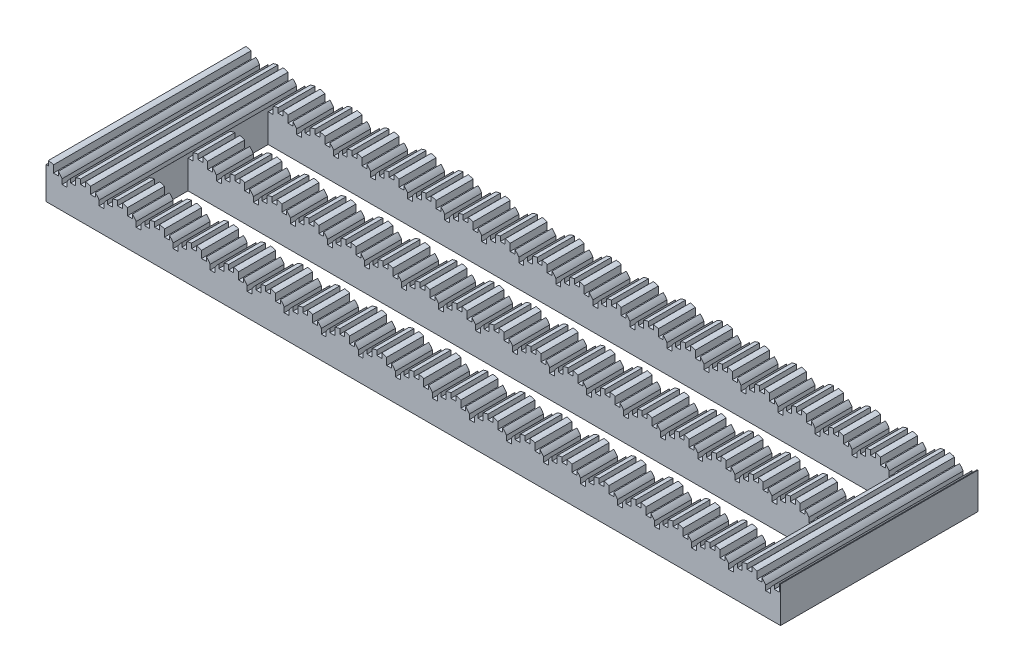
from build123d import *

# Parameters (mm, degrees)
SKETCH1_W           = 119
SKETCH1_H           = 32
SKETCH1_W_2         = 102.5
SKETCH1_H_2         = 7
BOSS_EXTRUDE1_DEPTH = 6
CUT_EXTRUDE1_DEPTH  = 45
SKETCH3_W           = 0.8
SKETCH3_H           = 1.606650318
SKETCH3_H_2         = 1.6
SKETCH3_H_3         = 0.8
SKETCH3_H_4         = 1.667937565
CUT_EXTRUDE2_DEPTH  = 68.825142831


with BuildPart() as part:
    # Sketch1 → Boss-Extrude1 (new body)
    with BuildSketch(Plane(origin=(0, 0, 0), x_dir=(1, 0, 0), z_dir=(0, 1, 0))):
        Rectangle(SKETCH1_W, SKETCH1_H)
        with Locations((1.75, 6.5)):
            Rectangle(SKETCH1_W_2, SKETCH1_H_2, mode=Mode.SUBTRACT)
        with Locations((1.75, -6.5)):
            Rectangle(SKETCH1_W_2, SKETCH1_H_2, mode=Mode.SUBTRACT)
    extrude(amount=BOSS_EXTRUDE1_DEPTH)

    # Sketch2 → Cut-Extrude1 (cut)
    with BuildSketch(Plane.XY.offset(16)):
        with BuildLine():
            Line((-56.582809571, 3.7), (-56.417190429, 3.7))
            ThreePointArc((-56.417190429, 3.7), (-53.5, 6), (-50.582809571, 3.7))
            Line((-50.582809571, 3.7), (-50.417190429, 3.7))
            ThreePointArc((-50.417190429, 3.7), (-47.5, 6), (-44.582809571, 3.7))
            Line((-44.582809571, 3.7), (-44.417190429, 3.7))
            ThreePointArc((-44.417190429, 3.7), (-41.5, 6), (-38.582809571, 3.7))
            Line((-38.582809571, 3.7), (-38.417190429, 3.7))
            ThreePointArc((-38.417190429, 3.7), (-35.5, 6), (-32.582809571, 3.7))
            Line((-32.582809571, 3.7), (-32.417190429, 3.7))
            ThreePointArc((-32.417190429, 3.7), (-29.5, 6), (-26.582809571, 3.7))
            Line((-26.582809571, 3.7), (-26.417190429, 3.7))
            ThreePointArc((-26.417190429, 3.7), (-23.5, 6), (-20.582809571, 3.7))
            Line((-20.582809571, 3.7), (-20.417190429, 3.7))
            ThreePointArc((-20.417190429, 3.7), (-17.5, 6), (-14.582809571, 3.7))
            Line((-14.582809571, 3.7), (-14.417190429, 3.7))
            ThreePointArc((-14.417190429, 3.7), (-11.5, 6), (-8.582809571, 3.7))
            Line((-8.582809571, 3.7), (-8.417190429, 3.7))
            ThreePointArc((-8.417190429, 3.7), (-5.5, 6), (-2.582809571, 3.7))
            Line((-2.582809571, 3.7), (-2.417190429, 3.7))
            ThreePointArc((-2.417190429, 3.7), (0.5, 6), (3.417190429, 3.7))
            Line((3.417190429, 3.7), (3.582809571, 3.7))
            ThreePointArc((3.582809571, 3.7), (6.5, 6), (9.417190429, 3.7))
            Line((9.417190429, 3.7), (9.582809571, 3.7))
            ThreePointArc((9.582809571, 3.7), (12.5, 6), (15.417190429, 3.7))
            Line((15.417190429, 3.7), (15.582809571, 3.7))
            ThreePointArc((15.582809571, 3.7), (18.5, 6), (21.417190429, 3.7))
            Line((21.417190429, 3.7), (21.582809571, 3.7))
            ThreePointArc((21.582809571, 3.7), (24.5, 6), (27.417190429, 3.7))
            Line((27.417190429, 3.7), (27.582809571, 3.7))
            ThreePointArc((27.582809571, 3.7), (30.5, 6), (33.417190429, 3.7))
            Line((33.417190429, 3.7), (33.582809571, 3.7))
            ThreePointArc((33.582809571, 3.7), (36.5, 6), (39.417190429, 3.7))
            Line((39.417190429, 3.7), (39.582809571, 3.7))
            ThreePointArc((39.582809571, 3.7), (42.5, 6), (45.417190429, 3.7))
            Line((45.417190429, 3.7), (45.582809571, 3.7))
            ThreePointArc((45.582809571, 3.7), (48.5, 6), (51.417190429, 3.7))
            Line((51.417190429, 3.7), (51.582809571, 3.7))
            ThreePointArc((51.582809571, 3.7), (54.5, 6), (57.417190429, 3.7))
            Line((57.417190429, 3.7), (57.582809571, 3.7))
            ThreePointArc((57.582809571, 3.7), (58.270954078, 5.007823269), (59.5, 5.828427125))
            Line((59.5, 5.828427125), (59.5, 9.854554483))
            Line((59.5, 9.854554483), (-59.5, 9.854554483))
            Line((-59.5, 9.854554483), (-59.5, 6))
            ThreePointArc((-59.5, 6), (-57.642582438, 5.355843798), (-56.582809571, 3.7))
        make_face()
    extrude(amount=-CUT_EXTRUDE1_DEPTH, mode=Mode.SUBTRACT)

    # Sketch3 → Cut-Extrude2 (cut, through all)
    with BuildSketch(Plane.XY.offset(16)):
        with Locations((-55.1, 5.403325159)):
            Rectangle(SKETCH3_W, SKETCH3_H)
        with Locations((-53.5, 6)):
            Rectangle(SKETCH3_W, SKETCH3_H_2)
        with Locations((-56.502032982, 4.096277251)):
            Rectangle(SKETCH3_W, SKETCH3_H_3)
        with Locations((-51.9, 5.433968783)):
            Rectangle(SKETCH3_W, SKETCH3_H_4)
        with Locations((-50.502032982, 4.096277251)):
            Rectangle(SKETCH3_W, SKETCH3_H_3)
        with Locations((-44.502032982, 4.096277251)):
            Rectangle(SKETCH3_W, SKETCH3_H_3)
        with Locations((-38.502032982, 4.096277251)):
            Rectangle(SKETCH3_W, SKETCH3_H_3)
        with Locations((-32.502032982, 4.096277251)):
            Rectangle(SKETCH3_W, SKETCH3_H_3)
        with Locations((-26.502032982, 4.096277251)):
            Rectangle(SKETCH3_W, SKETCH3_H_3)
        with Locations((-20.502032982, 4.096277251)):
            Rectangle(SKETCH3_W, SKETCH3_H_3)
        with Locations((-14.502032982, 4.096277251)):
            Rectangle(SKETCH3_W, SKETCH3_H_3)
        with Locations((-8.502032982, 4.096277251)):
            Rectangle(SKETCH3_W, SKETCH3_H_3)
        with Locations((-2.502032982, 4.096277251)):
            Rectangle(SKETCH3_W, SKETCH3_H_3)
        with Locations((3.497967018, 4.096277251)):
            Rectangle(SKETCH3_W, SKETCH3_H_3)
        with Locations((9.497967018, 4.096277251)):
            Rectangle(SKETCH3_W, SKETCH3_H_3)
        with Locations((15.497967018, 4.096277251)):
            Rectangle(SKETCH3_W, SKETCH3_H_3)
        with Locations((21.497967018, 4.096277251)):
            Rectangle(SKETCH3_W, SKETCH3_H_3)
        with Locations((27.497967018, 4.096277251)):
            Rectangle(SKETCH3_W, SKETCH3_H_3)
        with Locations((33.497967018, 4.096277251)):
            Rectangle(SKETCH3_W, SKETCH3_H_3)
        with Locations((39.497967018, 4.096277251)):
            Rectangle(SKETCH3_W, SKETCH3_H_3)
        with Locations((45.497967018, 4.096277251)):
            Rectangle(SKETCH3_W, SKETCH3_H_3)
        with Locations((51.497967018, 4.096277251)):
            Rectangle(SKETCH3_W, SKETCH3_H_3)
        with Locations((57.497967018, 4.096277251)):
            Rectangle(SKETCH3_W, SKETCH3_H_3)
        with Locations((-49.1, 5.403325159)):
            Rectangle(SKETCH3_W, SKETCH3_H)
        with Locations((-47.5, 6)):
            Rectangle(SKETCH3_W, SKETCH3_H_2)
        with Locations((-45.9, 5.433968783)):
            Rectangle(SKETCH3_W, SKETCH3_H_4)
        with Locations((-43.1, 5.403325159)):
            Rectangle(SKETCH3_W, SKETCH3_H)
        with Locations((-41.5, 6)):
            Rectangle(SKETCH3_W, SKETCH3_H_2)
        with Locations((-39.9, 5.433968783)):
            Rectangle(SKETCH3_W, SKETCH3_H_4)
        with Locations((-37.1, 5.403325159)):
            Rectangle(SKETCH3_W, SKETCH3_H)
        with Locations((-35.5, 6)):
            Rectangle(SKETCH3_W, SKETCH3_H_2)
        with Locations((-33.9, 5.433968783)):
            Rectangle(SKETCH3_W, SKETCH3_H_4)
        with Locations((-31.1, 5.403325159)):
            Rectangle(SKETCH3_W, SKETCH3_H)
        with Locations((-29.5, 6)):
            Rectangle(SKETCH3_W, SKETCH3_H_2)
        with Locations((-27.9, 5.433968783)):
            Rectangle(SKETCH3_W, SKETCH3_H_4)
        with Locations((-25.1, 5.403325159)):
            Rectangle(SKETCH3_W, SKETCH3_H)
        with Locations((-23.5, 6)):
            Rectangle(SKETCH3_W, SKETCH3_H_2)
        with Locations((-21.9, 5.433968783)):
            Rectangle(SKETCH3_W, SKETCH3_H_4)
        with Locations((-19.1, 5.403325159)):
            Rectangle(SKETCH3_W, SKETCH3_H)
        with Locations((-17.5, 6)):
            Rectangle(SKETCH3_W, SKETCH3_H_2)
        with Locations((-15.9, 5.433968783)):
            Rectangle(SKETCH3_W, SKETCH3_H_4)
        with Locations((-13.1, 5.403325159)):
            Rectangle(SKETCH3_W, SKETCH3_H)
        with Locations((-11.5, 6)):
            Rectangle(SKETCH3_W, SKETCH3_H_2)
        with Locations((-9.9, 5.433968783)):
            Rectangle(SKETCH3_W, SKETCH3_H_4)
        with Locations((-7.1, 5.403325159)):
            Rectangle(SKETCH3_W, SKETCH3_H)
        with Locations((-5.5, 6)):
            Rectangle(SKETCH3_W, SKETCH3_H_2)
        with Locations((-3.9, 5.433968783)):
            Rectangle(SKETCH3_W, SKETCH3_H_4)
        with Locations((-1.1, 5.403325159)):
            Rectangle(SKETCH3_W, SKETCH3_H)
        with Locations((0.5, 6)):
            Rectangle(SKETCH3_W, SKETCH3_H_2)
        with Locations((2.1, 5.433968783)):
            Rectangle(SKETCH3_W, SKETCH3_H_4)
        with Locations((4.9, 5.403325159)):
            Rectangle(SKETCH3_W, SKETCH3_H)
        with Locations((6.5, 6)):
            Rectangle(SKETCH3_W, SKETCH3_H_2)
        with Locations((8.1, 5.433968783)):
            Rectangle(SKETCH3_W, SKETCH3_H_4)
        with Locations((10.9, 5.403325159)):
            Rectangle(SKETCH3_W, SKETCH3_H)
        with Locations((12.5, 6)):
            Rectangle(SKETCH3_W, SKETCH3_H_2)
        with Locations((14.1, 5.433968783)):
            Rectangle(SKETCH3_W, SKETCH3_H_4)
        with Locations((16.9, 5.403325159)):
            Rectangle(SKETCH3_W, SKETCH3_H)
        with Locations((18.5, 6)):
            Rectangle(SKETCH3_W, SKETCH3_H_2)
        with Locations((20.1, 5.433968783)):
            Rectangle(SKETCH3_W, SKETCH3_H_4)
        with Locations((22.9, 5.403325159)):
            Rectangle(SKETCH3_W, SKETCH3_H)
        with Locations((24.5, 6)):
            Rectangle(SKETCH3_W, SKETCH3_H_2)
        with Locations((26.1, 5.433968783)):
            Rectangle(SKETCH3_W, SKETCH3_H_4)
        with Locations((28.9, 5.403325159)):
            Rectangle(SKETCH3_W, SKETCH3_H)
        with Locations((30.5, 6)):
            Rectangle(SKETCH3_W, SKETCH3_H_2)
        with Locations((32.1, 5.433968783)):
            Rectangle(SKETCH3_W, SKETCH3_H_4)
        with Locations((34.9, 5.403325159)):
            Rectangle(SKETCH3_W, SKETCH3_H)
        with Locations((36.5, 6)):
            Rectangle(SKETCH3_W, SKETCH3_H_2)
        with Locations((38.1, 5.433968783)):
            Rectangle(SKETCH3_W, SKETCH3_H_4)
        with Locations((40.9, 5.403325159)):
            Rectangle(SKETCH3_W, SKETCH3_H)
        with Locations((42.5, 6)):
            Rectangle(SKETCH3_W, SKETCH3_H_2)
        with Locations((44.1, 5.433968783)):
            Rectangle(SKETCH3_W, SKETCH3_H_4)
        with Locations((46.9, 5.403325159)):
            Rectangle(SKETCH3_W, SKETCH3_H)
        with Locations((48.5, 6)):
            Rectangle(SKETCH3_W, SKETCH3_H_2)
        with Locations((50.1, 5.433968783)):
            Rectangle(SKETCH3_W, SKETCH3_H_4)
        with Locations((52.9, 5.403325159)):
            Rectangle(SKETCH3_W, SKETCH3_H)
        with Locations((54.5, 6)):
            Rectangle(SKETCH3_W, SKETCH3_H_2)
        with Locations((56.1, 5.433968783)):
            Rectangle(SKETCH3_W, SKETCH3_H_4)
        with Locations((58.9, 5.403325159)):
            Rectangle(SKETCH3_W, SKETCH3_H)
        with Locations((60.5, 6)):
            Rectangle(SKETCH3_W, SKETCH3_H_2)
        with Locations((62.1, 5.433968783)):
            Rectangle(SKETCH3_W, SKETCH3_H_4)
        with Locations((64.9, 5.403325159)):
            Rectangle(SKETCH3_W, SKETCH3_H)
        with Locations((66.5, 6)):
            Rectangle(SKETCH3_W, SKETCH3_H_2)
        with Locations((68.1, 5.433968783)):
            Rectangle(SKETCH3_W, SKETCH3_H_4)
        with Locations((-59.5, 6)):
            Rectangle(SKETCH3_W, SKETCH3_H_2)
        with Locations((-57.9, 5.433968783)):
            Rectangle(SKETCH3_W, SKETCH3_H_4)
        with Locations((-61.1, 5.403325159)):
            Rectangle(SKETCH3_W, SKETCH3_H)
    extrude(amount=-CUT_EXTRUDE2_DEPTH, mode=Mode.SUBTRACT)


solid = part.part
